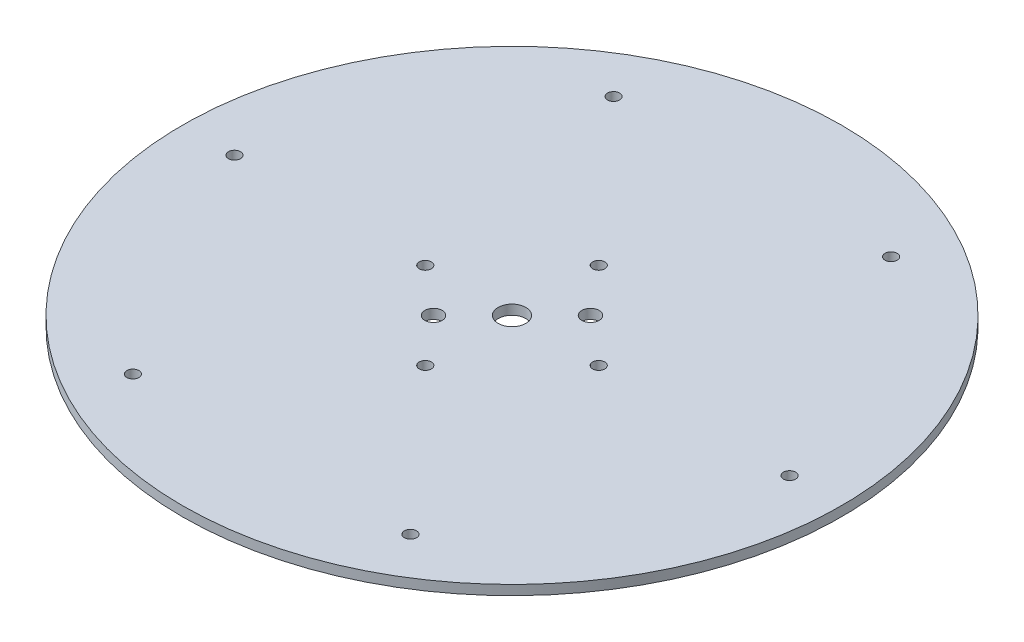
from build123d import *

# Parameters (mm, degrees)
SKETCH1_R           = 95
SKETCH1_R_2         = 1.75
BOSS_EXTRUDE1_DEPTH = 2.8
SKETCH2_R           = 4
SKETCH2_R_2         = 2.5
CUT_EXTRUDE1_DEPTH  = 10


with BuildPart() as part:
    # Sketch1 → Boss-Extrude1 (new body)
    with BuildSketch(Plane(origin=(0, 0, 0), x_dir=(1, 0, 0), z_dir=(0, 1, 0))):
        with Locations(Location((0, 0, 0), (0, 0, 270))):
            Circle(SKETCH1_R)
        with Locations(Location((80, 0, 0), (0, 0, 270))):
            Circle(SKETCH1_R_2, mode=Mode.SUBTRACT)
        with Locations(Location((40, -69.282032303, 0), (0, 0, 270))):
            Circle(SKETCH1_R_2, mode=Mode.SUBTRACT)
        with Locations(Location((-40, -69.282032303, 0), (0, 0, 270))):
            Circle(SKETCH1_R_2, mode=Mode.SUBTRACT)
        with Locations(Location((-80, 0, 0), (0, 0, 270))):
            Circle(SKETCH1_R_2, mode=Mode.SUBTRACT)
        with Locations(Location((-40, 69.282032303, 0), (0, 0, 270))):
            Circle(SKETCH1_R_2, mode=Mode.SUBTRACT)
        with Locations(Location((40, 69.282032303, 0), (0, 0, 270))):
            Circle(SKETCH1_R_2, mode=Mode.SUBTRACT)
        with Locations(Location((0, 25, 0), (0, 0, 270))):
            Circle(SKETCH1_R_2, mode=Mode.SUBTRACT)
        with Locations(Location((25, 0, 0), (0, 0, 270))):
            Circle(SKETCH1_R_2, mode=Mode.SUBTRACT)
        with Locations(Location((0, -25, 0), (0, 0, 270))):
            Circle(SKETCH1_R_2, mode=Mode.SUBTRACT)
        with Locations(Location((-25, 0, 0), (0, 0, 270))):
            Circle(SKETCH1_R_2, mode=Mode.SUBTRACT)
    extrude(amount=BOSS_EXTRUDE1_DEPTH)

    # Sketch2 → Cut-Extrude1 (cut)
    with BuildSketch(Plane(origin=(0, 2.8, 0), x_dir=(1, 0, 0), z_dir=(0, 1, 0))):
        with Locations(Location((0, 0, 0), (0, 0, 270))):
            Circle(SKETCH2_R)
        with Locations(Location((11.313708499, 11.313708499, 0), (0, 0, 270))):
            Circle(SKETCH2_R_2)
        with Locations(Location((-11.313708499, -11.313708499, 0), (0, 0, 270))):
            Circle(SKETCH2_R_2)
    extrude(amount=-CUT_EXTRUDE1_DEPTH, mode=Mode.SUBTRACT)


solid = part.part
